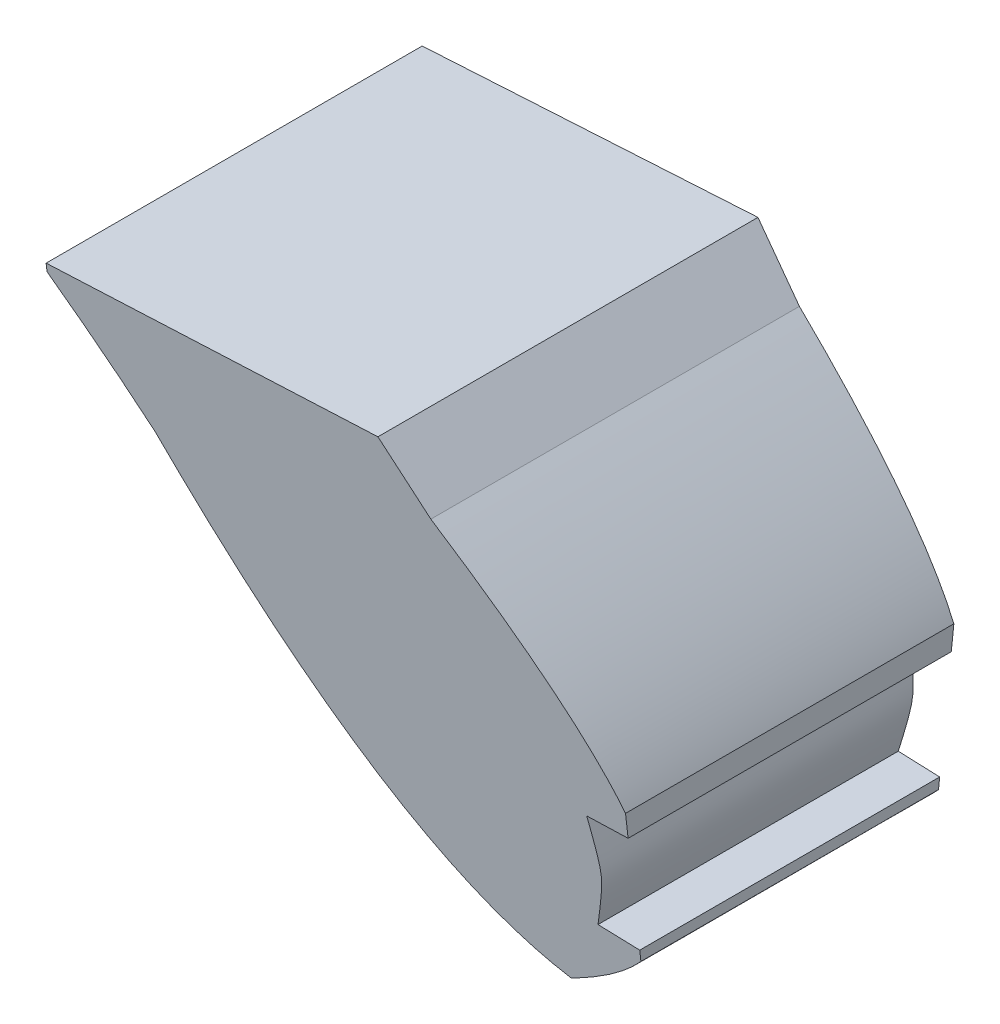
from build123d import *

# Parameters (mm, degrees)
SALIENTE_EXTRUIR1_DEPTH      = 8
SALIENTE_EXTRUIR2_DEPTH      = 8
SALIENTE_EXTRUIR2_DEPTH_BACK = 8
CORTAR_EXTRUIR2_DEPTH        = 28.452126486
CORTAR_EXTRUIR2_DEPTH_BACK   = 28.452126486


with BuildPart() as part:
    # Croquis1 → Saliente-Extruir1 (new, symmetric)
    with BuildSketch(Plane.XY):
        with BuildLine():
            add(Edge.make_bspline(
                [(-18.945192114, 7.540918896), (-10.215008384, -3.697644103), (-2.846604825, -5.059081104)],
                knots=[0.497667241, 0.497667241, 0.497667241, 0.49955428, 0.49955428, 0.49955428], degree=2, weights=[1, 1, 1]))
            add(Edge.make_bspline(
                [(-2.846604825, -5.059081104), (-0.742366882, -3.9352066), (0.355125, -2.723253227)],
                knots=[0.498812075, 0.498812075, 0.498812075, 0.499412845, 0.499412845, 0.499412845], degree=2, weights=[1, 1, 1]))
            Line((0.355125, -2.723253227), (0.355125, -2.284841781))
            Line((0.355125, -2.284841781), (-1.394875, -2.223730435))
            add(Edge.make_bspline(
                [(-1.394875, -2.223730435), (-0.90753067, -0.123730435), (-1.394875, 1.976269565)],
                knots=[0, 0, 0, 1, 1, 1], degree=2, weights=[1, 3.231801219, 1]))
            Line((-1.394875, 1.976269565), (0.355125, 2.284841781))
            Line((0.355125, 2.284841781), (0.355125, 3.001549529))
            add(Edge.make_bspline(
                [(0.355125, 3.001549529), (-1.44872627, 6.058427314), (-6.994875026, 10.477389992)],
                knots=[0.500820705, 0.500820705, 0.500820705, 0.502013312, 0.502013312, 0.502013312], degree=2, weights=[1, 1, 1]))
            Line((-6.994875026, 10.477389992), (-8.981845695, 12.608155172))
            Line((-8.981845695, 12.608155172), (-23.035921146, 11.871612288))
            Line((-23.035921146, 11.871612288), (-23.035921146, 11.54013782))
            ThreePointArc((-23.035921146, 11.54013782), (-20.949684518, 9.582335705), (-18.945192114, 7.540918896))
        make_face()
    extrude(amount=SALIENTE_EXTRUIR1_DEPTH, both=True)

    # Croquis4 → Saliente-Extruir2 (add, two sides: drawn at the far end of the back side and taken through both)
    with BuildSketch(Plane.XY.offset(-SALIENTE_EXTRUIR2_DEPTH_BACK)):
        Polygon((-1.394875, 1.976269565), (0.355125, 2.284841781), (0.355125, 2.037380912), align=None)
    extrude(amount=SALIENTE_EXTRUIR2_DEPTH + SALIENTE_EXTRUIR2_DEPTH_BACK)

    # Croquis6 → Cortar-Extruir2 (cut, two sides: drawn at the far end of the back side and taken through both)
    with BuildSketch(Plane(origin=(0, 0, 0), x_dir=(0, 0, -1), z_dir=(1, 0, 0)).offset(-CORTAR_EXTRUIR2_DEPTH_BACK)):
        Polygon((8, 12.608155172), (8, -5.059081104), (6, -5.059081104), align=None)
        Polygon((-8, 12.608155172), (-8, -5.059081104), (-6, -5.059081104), align=None)
    extrude(amount=CORTAR_EXTRUIR2_DEPTH + CORTAR_EXTRUIR2_DEPTH_BACK, mode=Mode.SUBTRACT)


solid = part.part
